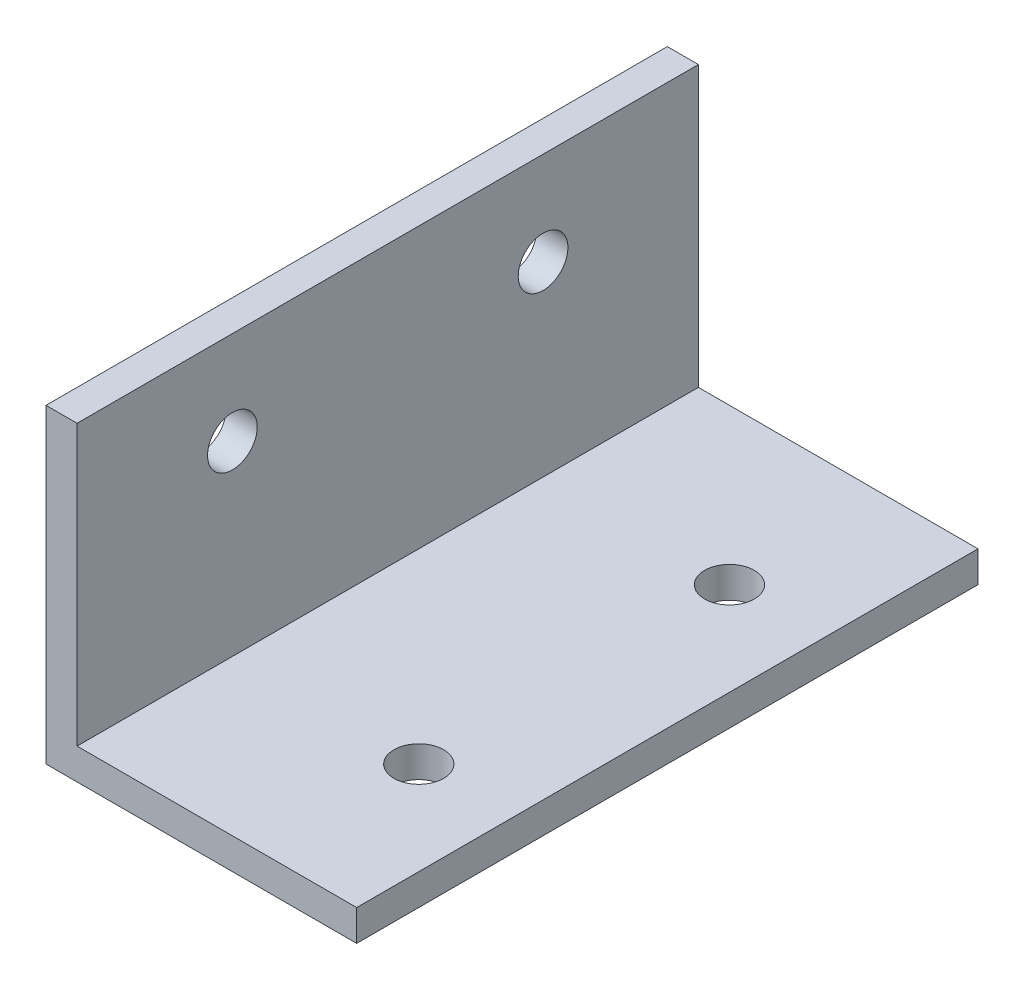
from build123d import *

# Parameters (mm, degrees)
BOSS_EXTRUDE1_DEPTH = 50
SKETCH3_R           = 4
CUT_EXTRUDE1_DEPTH  = 84.815273071
SKETCH2_R           = 4
CUT_EXTRUDE2_DEPTH  = 200


with BuildPart() as part:
    # Sketch1 → Boss-Extrude1 (new, symmetric)
    with BuildSketch(Plane.XY):
        Polygon((0, 50), (5, 50), (5, 5), (50, 5), (50, 0), (0, 0), align=None)
    extrude(amount=BOSS_EXTRUDE1_DEPTH, both=True)

    # Sketch3 → Cut-Extrude1 (cut, through all)
    with BuildSketch(Plane(origin=(0, 5, 0), x_dir=(1, 0, 0), z_dir=(0, 1, 0))):
        with Locations(Location((35, 25, 0), (0, 0, 180))):
            Circle(SKETCH3_R)
        with Locations(Location((35, -25, 0), (0, 0, 180))):
            Circle(SKETCH3_R)
    extrude(amount=-CUT_EXTRUDE1_DEPTH, mode=Mode.SUBTRACT)

    # Sketch2 → Cut-Extrude2 (cut)
    with BuildSketch(Plane(origin=(5, 0, 0), x_dir=(0, 0, -1), z_dir=(1, 0, 0))):
        with Locations(Location((-25, 35, 0), (0, 0, 90))):
            Circle(SKETCH2_R)
        with Locations(Location((25, 35, 0), (0, 0, 90))):
            Circle(SKETCH2_R)
    extrude(amount=-CUT_EXTRUDE2_DEPTH, mode=Mode.SUBTRACT)


solid = part.part
